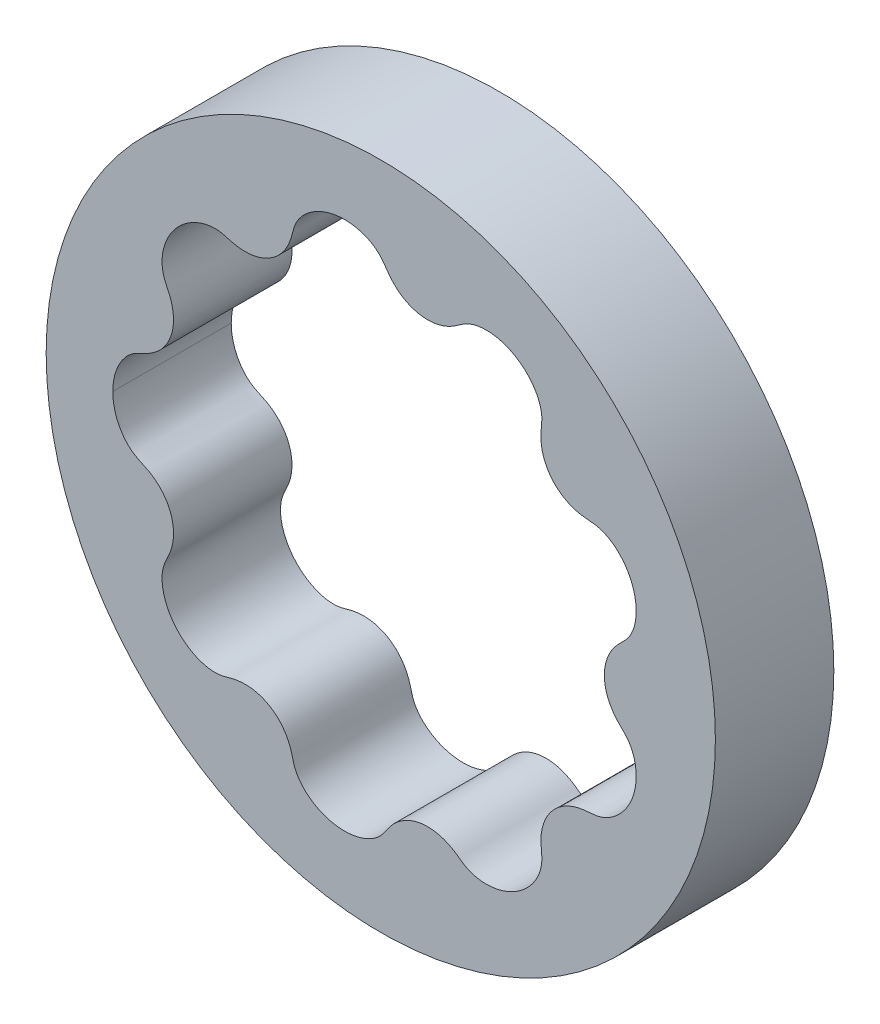
from build123d import *

# Parameters (mm, degrees)
ESQUISSE1_R        = 11.3
BOSS_EXTRU_4_DEPTH = 4


with BuildPart() as part:
    # Esquisse1 → Boss.-Extru.4 (new body)
    with BuildSketch(Plane.XY):
        Circle(ESQUISSE1_R)
        with BuildLine():
            add(Edge.make_bspline(
                [(7.55, 0), (7.55, -0.022217466), (7.551097377, -0.06660344), (7.556035758, -0.154882158), (7.569167839, -0.254768485), (7.592785481, -0.37435883), (7.631791074, -0.513440089), (7.699599827, -0.686174715), (7.809747013, -0.886363911), (7.938343435, -1.056119454), (8.074367238, -1.199477561), (8.213906261, -1.331108701), (8.363463314, -1.489503642), (8.52117397, -1.760296749), (8.622800912, -2.12120006), (8.639980023, -2.525427279), (8.572560565, -2.925228783), (8.443226846, -3.278721943), (8.236791431, -3.626307028), (7.959315156, -3.92599456), (7.644146129, -4.137037381), (7.344330807, -4.240981402), (7.118477365, -4.261750803), (6.923409824, -4.274042572), (6.729494296, -4.299433334), (6.479039378, -4.361323849), (6.185584384, -4.492786475), (5.900995311, -4.701343321), (5.654616476, -4.994966266), (5.498646357, -5.311447235), (5.420139001, -5.62327233), (5.402679566, -5.880669299), (5.411348006, -6.076048137), (5.43311542, -6.27028614), (5.451881775, -6.496315743), (5.401577193, -6.809624445), (5.248472533, -7.156654923), (5.00151571, -7.481952038), (4.693155209, -7.747259736), (4.362746137, -7.938021502), (3.97880268, -8.072415681), (3.573608703, -8.123638006), (3.196519164, -8.082715292), (2.900033577, -7.969625987), (2.713669376, -7.840359047), (2.556338037, -7.724388907), (2.391469223, -7.619192408), (2.159827187, -7.505614223), (1.850525062, -7.417691062), (1.498459434, -7.394524629), (1.120985101, -7.461083539), (0.798075015, -7.603266401), (0.537497583, -7.791674704), (0.358671298, -7.977629529), (0.239724611, -8.132870358), (0.131545637, -8.295657129), (0.00063247, -8.48086863), (-0.239294028, -8.688541859), (-0.579645892, -8.855968849), (-0.97792275, -8.946420111), (-1.384677099, -8.951447289), (-1.760404432, -8.885196422), (-2.140909097, -8.74135424), (-2.484230767, -8.520139149), (-2.7467935, -8.246402048), (-2.901222232, -7.969193352), (-2.960894305, -7.750376531), (-3.006872934, -7.560407615), (-3.065550767, -7.373846791), (-3.169992211, -7.137944222), (-3.350415467, -6.871775601), (-3.605222288, -6.627725658), (-3.937167647, -6.43607692), (-4.275924503, -6.337432703), (-4.596644926, -6.314265903), (-4.853163255, -6.341768224), (-5.044068602, -6.384232176), (-5.231575792, -6.439397912), (-5.450912809, -6.497128898), (-5.76819685, -6.501993852), (-6.136541661, -6.411476718), (-6.499780125, -6.224758472), (-6.814603855, -5.967153659), (-7.059841778, -5.674888364), (-7.258866454, -5.320117434), (-7.379669823, -4.929970109), (-7.404852791, -4.55150919), (-7.344961354, -4.239881617), (-7.250026908, -4.033914986), (-7.163124623, -3.858808158), (-7.088186053, -3.678236185), (-7.016506455, -3.430291501), (-6.983703661, -3.110565989), (-7.022944536, -2.75014551), (-7.163870523, -2.373055201), (-7.388807145, -2.052464473), (-7.674915576, -1.804887015), (-7.961757696, -1.643613759), (-8.223794342, -1.543858612), (-8.434276899, -1.408170219), (-8.59255306, -1.258153379), (-8.722053282, -1.095509906), (-8.824645601, -0.92839368), (-8.906281505, -0.753480862), (-8.96818609, -0.584253866), (-9.011618341, -0.402056601), (-9.038496186, -0.253381349), (-9.048010833, -0.099975464), (-9.05, -0.033884546), (-9.05, 0)],
                knots=[0.065203343, 0.065203343, 0.065203343, 0.065203343, 0.065203343, 0.068090592, 0.070977842, 0.073865091, 0.076752341, 0.081991863, 0.087231386, 0.094866257, 0.102501127, 0.106027866, 0.109554606, 0.116608084, 0.127054156, 0.141092789, 0.151537705, 0.161982622, 0.17271144, 0.183440258, 0.19705009, 0.20778349, 0.215195934, 0.218902157, 0.222608379, 0.229945233, 0.237282087, 0.248011645, 0.25876192, 0.269512195, 0.280241753, 0.287578607, 0.294915461, 0.298621683, 0.302327905, 0.30974035, 0.32047375, 0.334083582, 0.3448124, 0.355541218, 0.366270036, 0.376998854, 0.390608687, 0.401342087, 0.408754531, 0.412460753, 0.416166975, 0.423503829, 0.430840684, 0.441570242, 0.452320517, 0.463070792, 0.47380035, 0.481137204, 0.488474058, 0.49218028, 0.495886502, 0.503298946, 0.514032347, 0.527642179, 0.538370997, 0.549099815, 0.559828633, 0.570557451, 0.584167283, 0.594900684, 0.602313128, 0.60601935, 0.609725572, 0.617062426, 0.62439928, 0.635128838, 0.645879113, 0.656629388, 0.667358947, 0.674695801, 0.682032655, 0.685738877, 0.689445099, 0.696857543, 0.707590944, 0.721200776, 0.731929594, 0.742658412, 0.75338723, 0.764116048, 0.77772588, 0.78845928, 0.795871725, 0.799577947, 0.803284169, 0.810621023, 0.817957877, 0.828687435, 0.83943771, 0.851255103, 0.863061334, 0.872486065, 0.881910795, 0.888312532, 0.894714268, 0.900613035, 0.906511803, 0.911736381, 0.91696096, 0.922185538, 0.927410117, 0.931813551, 0.936216984, 0.936216984, 0.936216984, 0.936216984, 0.936216984], degree=4))
            add(Edge.make_bspline(
                [(7.55, 0), (7.55, 0.022217466), (7.551097377, 0.06660344), (7.556035758, 0.154882158), (7.569167839, 0.254768485), (7.592785481, 0.37435883), (7.631791074, 0.513440089), (7.699599827, 0.686174715), (7.809747013, 0.886363911), (7.938343435, 1.056119454), (8.074367238, 1.199477561), (8.213906261, 1.331108701), (8.363463314, 1.489503642), (8.52117397, 1.760296749), (8.622800912, 2.12120006), (8.639980023, 2.525427279), (8.572560565, 2.925228783), (8.443226846, 3.278721943), (8.236791431, 3.626307028), (7.959315156, 3.92599456), (7.644146129, 4.137037381), (7.344330807, 4.240981402), (7.118477365, 4.261750803), (6.923409824, 4.274042572), (6.729494296, 4.299433334), (6.479039378, 4.361323849), (6.185584384, 4.492786475), (5.900995311, 4.701343321), (5.654616476, 4.994966266), (5.498646357, 5.311447235), (5.420139001, 5.62327233), (5.402679566, 5.880669299), (5.411348006, 6.076048137), (5.43311542, 6.27028614), (5.451881775, 6.496315743), (5.401577193, 6.809624445), (5.248472533, 7.156654923), (5.00151571, 7.481952038), (4.693155209, 7.747259736), (4.362746137, 7.938021502), (3.97880268, 8.072415681), (3.573608703, 8.123638006), (3.196519164, 8.082715292), (2.900033577, 7.969625986), (2.713669376, 7.840359047), (2.556338037, 7.724388907), (2.391469223, 7.619192408), (2.159827187, 7.505614223), (1.850525062, 7.417691062), (1.498459434, 7.394524629), (1.120985101, 7.461083539), (0.798075015, 7.603266401), (0.537497583, 7.791674704), (0.358671298, 7.977629529), (0.239724611, 8.132870358), (0.131545637, 8.295657129), (0.00063247, 8.48086863), (-0.239294028, 8.688541859), (-0.579645892, 8.855968849), (-0.97792275, 8.946420111), (-1.384677099, 8.951447289), (-1.760404432, 8.885196422), (-2.140909097, 8.74135424), (-2.484230767, 8.520139149), (-2.7467935, 8.246402048), (-2.901222232, 7.969193352), (-2.960894305, 7.750376531), (-3.006872934, 7.560407615), (-3.065550767, 7.373846791), (-3.169992211, 7.137944222), (-3.350415467, 6.871775601), (-3.605222288, 6.627725658), (-3.937167647, 6.43607692), (-4.275924503, 6.337432703), (-4.596644926, 6.314265903), (-4.853163255, 6.341768224), (-5.044068602, 6.384232176), (-5.231575792, 6.439397912), (-5.450912809, 6.497128898), (-5.76819685, 6.501993852), (-6.136541661, 6.411476718), (-6.499780125, 6.224758472), (-6.814603855, 5.967153659), (-7.059841778, 5.674888364), (-7.258866454, 5.320117434), (-7.379669823, 4.929970109), (-7.404852791, 4.55150919), (-7.344961354, 4.239881617), (-7.250026908, 4.033914986), (-7.163124623, 3.858808158), (-7.088186053, 3.678236185), (-7.016506455, 3.430291501), (-6.983703661, 3.110565989), (-7.022944536, 2.75014551), (-7.163870523, 2.373055201), (-7.388807145, 2.052464473), (-7.674915576, 1.804887015), (-7.961757696, 1.643613759), (-8.223794342, 1.543858612), (-8.434276899, 1.408170219), (-8.59255306, 1.258153379), (-8.722053282, 1.095509906), (-8.824645601, 0.92839368), (-8.906281505, 0.753480862), (-8.96818609, 0.584253866), (-9.011618341, 0.402056601), (-9.038496186, 0.253381349), (-9.048010833, 0.099975464), (-9.05, 0.033884546), (-9.05, 0)],
                knots=[0.065203343, 0.065203343, 0.065203343, 0.065203343, 0.065203343, 0.068090592, 0.070977842, 0.073865091, 0.076752341, 0.081991863, 0.087231386, 0.094866257, 0.102501127, 0.106027866, 0.109554606, 0.116608084, 0.127054156, 0.141092789, 0.151537705, 0.161982622, 0.17271144, 0.183440258, 0.19705009, 0.20778349, 0.215195934, 0.218902157, 0.222608379, 0.229945233, 0.237282087, 0.248011645, 0.25876192, 0.269512195, 0.280241753, 0.287578607, 0.294915461, 0.298621683, 0.302327905, 0.30974035, 0.32047375, 0.334083582, 0.3448124, 0.355541218, 0.366270036, 0.376998854, 0.390608687, 0.401342087, 0.408754531, 0.412460753, 0.416166975, 0.423503829, 0.430840684, 0.441570242, 0.452320517, 0.463070792, 0.47380035, 0.481137204, 0.488474058, 0.49218028, 0.495886502, 0.503298946, 0.514032347, 0.527642179, 0.538370997, 0.549099815, 0.559828633, 0.570557451, 0.584167283, 0.594900684, 0.602313128, 0.60601935, 0.609725572, 0.617062426, 0.62439928, 0.635128838, 0.645879113, 0.656629388, 0.667358947, 0.674695801, 0.682032655, 0.685738877, 0.689445099, 0.696857543, 0.707590944, 0.721200776, 0.731929594, 0.742658412, 0.75338723, 0.764116048, 0.77772588, 0.78845928, 0.795871725, 0.799577947, 0.803284169, 0.810621023, 0.817957877, 0.828687435, 0.83943771, 0.851255103, 0.863061334, 0.872486065, 0.881910795, 0.888312532, 0.894714268, 0.900613035, 0.906511803, 0.911736381, 0.91696096, 0.922185538, 0.927410117, 0.931813551, 0.936216984, 0.936216984, 0.936216984, 0.936216984, 0.936216984], degree=4))
        make_face(mode=Mode.SUBTRACT)
    extrude(amount=BOSS_EXTRU_4_DEPTH)


solid = part.part
